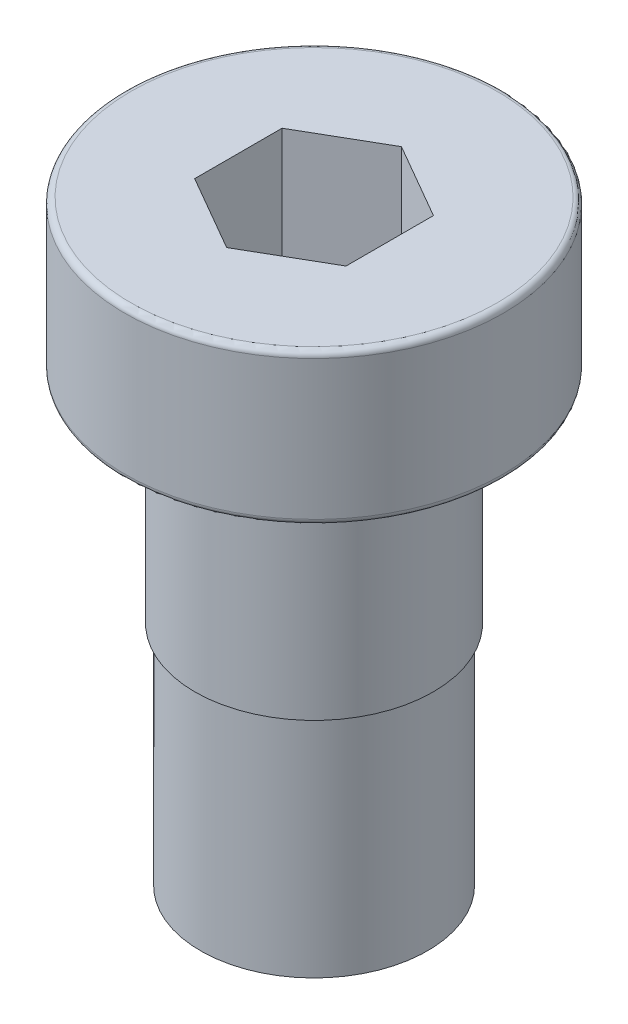
from build123d import *

# Parameters (mm, degrees)
CUT_EXTRUDE1_DEPTH = 6.35
FILLET1_R          = 0.254
FILLET2_R          = 0.254


with BuildPart() as part:
    # Sketch1 → Revolve1 (revolve)
    with BuildSketch(Plane.XY):
        Polygon((4.7625, -4.56311), (5, -4.56311), (5, 4.56311), (7.9375, 4.56311), (7.9375, 10.91311), (0, 10.91311), (0, -14.08811), (4.7625, -14.08811), align=None)
    revolve(axis=Axis((0, -16.678845395, 0), (0, -1, 0)))

    # Sketch2 → Cut-Extrude1 (cut)
    with BuildSketch(Plane(origin=(0, 10.91311, 0), x_dir=(1, 0, 0), z_dir=(0, 1, 0))):
        Polygon((0, 3.666174209), (-3.175, 1.833087105), (-3.175, -1.833087105), (0, -3.666174209), (3.175, -1.833087105), (3.175, 1.833087105), align=None)
    extrude(amount=-CUT_EXTRUDE1_DEPTH, mode=Mode.SUBTRACT)

    # Fillet1
    fillet1_edges = [part.edges().sort_by_distance(p)[0] for p in [
        (-5, 4.56311, 0),
    ]]
    fillet(fillet1_edges, radius=FILLET1_R)

    # Fillet2
    fillet2_edges = [part.edges().sort_by_distance(p)[0] for p in [
        (-7.9375, 10.91311, 0),
        (-7.9375, 4.56311, 0),
    ]]
    fillet(fillet2_edges, radius=FILLET2_R)


solid = part.part
